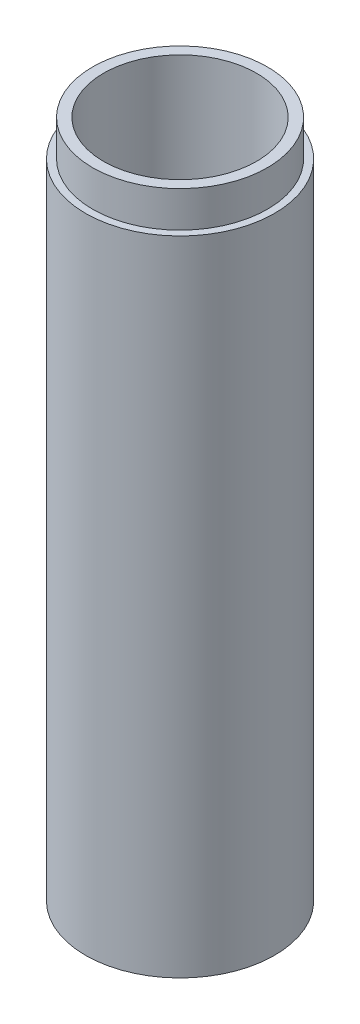
from build123d import *


with BuildPart() as part:
    # Sketch2 → Revolve2 (revolve)
    with BuildSketch(Plane.XY, mode=Mode.PRIVATE) as revolve2_sk:
        Polygon((11.55813899, 85), (11.55813899, 89.7625), (10.11875, 89.7625), (10.11875, 2.38125), (0, 2.38125), (0, 0), (10.11875, 0), (12.5, 0), (12.5, 85), align=None)
    revolve(revolve2_sk.sketch.rotate(Axis((0, 96.789249838, 0), (0, -1, 0)), 90), axis=Axis((0, 96.789249838, 0), (0, -1, 0)))


solid = part.part
